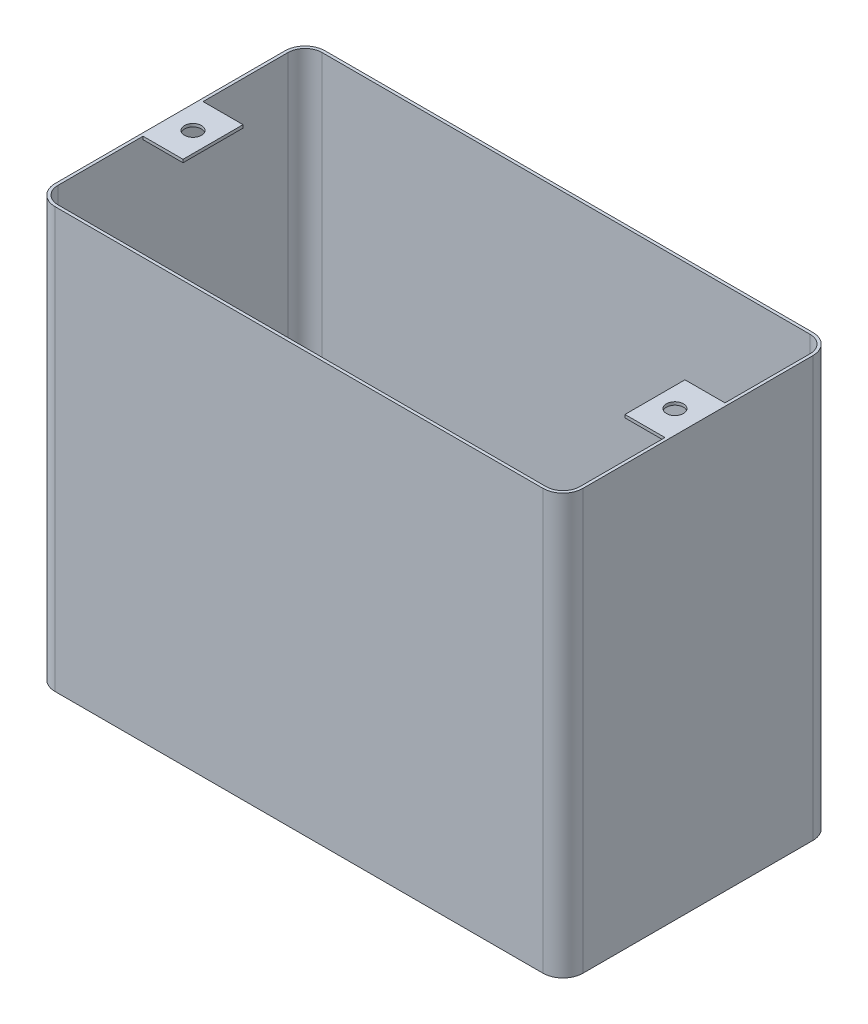
from build123d import *

# Parameters (mm, degrees)
ESTRUSIONE_SOTTILE1_DEPTH    = 210
SCHIZZO2_W                   = 20
SCHIZZO2_H                   = 30
SCHIZZO2_R                   = 4.25
ESTRUSIONE_ESTRUSIONE1_DEPTH = 1.5


with BuildPart() as part:
    # Schizzo1 → Estrusione-Sottile1 (new body)
    with BuildSketch(Plane(origin=(0, 0, 0), x_dir=(1, 0, 0), z_dir=(0, 1, 0))):
        with BuildLine():
            Line((0, 125), (0, 10))
            ThreePointArc((0, 10), (2.928932188, 2.928932188), (10, 0))
            Line((10, 0), (254, 0))
            ThreePointArc((254, 0), (261.071067812, 2.928932188), (264, 10))
            Line((264, 10), (264, 125))
            ThreePointArc((264, 125), (261.071067812, 132.071067812), (254, 135))
            Line((254, 135), (10, 135))
            ThreePointArc((10, 135), (2.928932188, 132.071067812), (0, 125))
        make_face()
        with BuildLine():
            Line((1.5, 125), (1.5, 10))
            ThreePointArc((1.5, 10), (3.98959236, 3.98959236), (10, 1.5))
            Line((10, 1.5), (254, 1.5))
            ThreePointArc((254, 1.5), (260.01040764, 3.98959236), (262.5, 10))
            Line((262.5, 10), (262.5, 125))
            ThreePointArc((262.5, 125), (260.01040764, 131.01040764), (254, 133.5))
            Line((254, 133.5), (10, 133.5))
            ThreePointArc((10, 133.5), (3.98959236, 131.01040764), (1.5, 125))
        make_face(mode=Mode.SUBTRACT)
    extrude(amount=ESTRUSIONE_SOTTILE1_DEPTH)

    # Schizzo2 → Estrusione-Estrusione1 (add)
    # profile 1 of 2: a face of its own
    with BuildSketch(Plane(origin=(0, 210, 0), x_dir=(1, 0, 0), z_dir=(0, 1, 0))):
        with Locations((11.5, 67.5)):
            Rectangle(SCHIZZO2_W, SCHIZZO2_H)
        with Locations(Location((11.5, 67.5, 0), (0, 0, 270))):
            Circle(SCHIZZO2_R, mode=Mode.SUBTRACT)
    # profile 2 of 2: a face of its own
    with BuildSketch(Plane(origin=(0, 210, 0), x_dir=(1, 0, 0), z_dir=(0, 1, 0))):
        with Locations((252.5, 67.5)):
            Rectangle(SCHIZZO2_W, SCHIZZO2_H)
        with Locations(Location((252.5, 67.5, 0), (0, 0, 90))):
            Circle(SCHIZZO2_R, mode=Mode.SUBTRACT)
    extrude(amount=-ESTRUSIONE_ESTRUSIONE1_DEPTH)


solid = part.part
